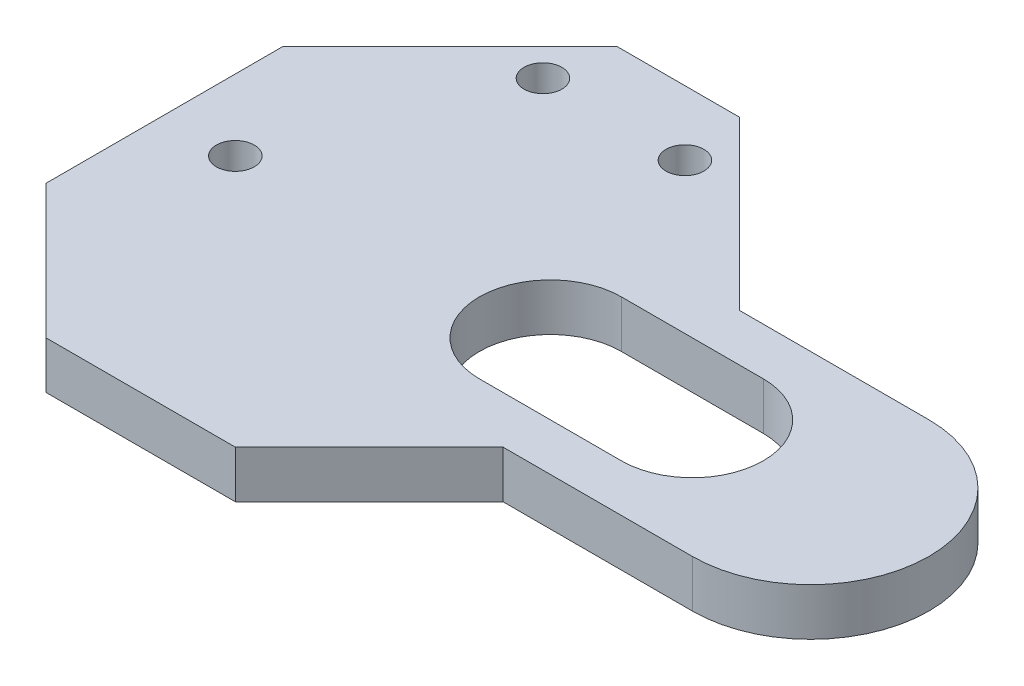
from build123d import *

# Parameters (mm, degrees)
SKETCH1_R           = 4
BOSS_EXTRUDE1_DEPTH = 10


with BuildPart() as part:
    # Sketch1 → Boss-Extrude1 (new body)
    with BuildSketch(Plane(origin=(0, 0, 0), x_dir=(1, 0, 0), z_dir=(0, 1, 0))):
        with BuildLine():
            Line((0, 0), (40, 0))
            Line((40, 0), (68.284271247, 28.284271247))
            Line((68.284271247, 28.284271247), (108.284271247, 28.284271247))
            ThreePointArc((108.284271247, 28.284271247), (133.284271247, 53.284271247), (108.284271247, 78.284271247))
            Line((108.284271247, 78.284271247), (68.284271247, 78.284271247))
            Line((68.284271247, 78.284271247), (32.928932188, 113.639610307))
            Line((32.928932188, 113.639610307), (7.071067812, 113.639610307))
            Line((7.071067812, 113.639610307), (-28.284271247, 78.284271247))
            Line((-28.284271247, 78.284271247), (-28.284271247, 28.284271247))
            Line((-28.284271247, 28.284271247), (0, 0))
        make_face()
        with Locations(Location((5, 100, 0), (0, 0, 270))):
            Circle(SKETCH1_R, mode=Mode.SUBTRACT)
        with Locations(Location((35, 100, 0), (0, 0, 270))):
            Circle(SKETCH1_R, mode=Mode.SUBTRACT)
        with Locations(Location((-13.284271247, 53.284271247, 0), (0, 0, 270))):
            Circle(SKETCH1_R, mode=Mode.SUBTRACT)
        with BuildLine():
            Line((53.284271247, 68.284271247), (83.284271247, 68.284271247))
            ThreePointArc((83.284271247, 68.284271247), (98.284271247, 53.284271247), (83.284271247, 38.284271247))
            Line((83.284271247, 38.284271247), (53.284271247, 38.284271247))
            ThreePointArc((53.284271247, 38.284271247), (38.284271247, 53.284271247), (53.284271247, 68.284271247))
        make_face(mode=Mode.SUBTRACT)
    extrude(amount=BOSS_EXTRUDE1_DEPTH)


solid = part.part
